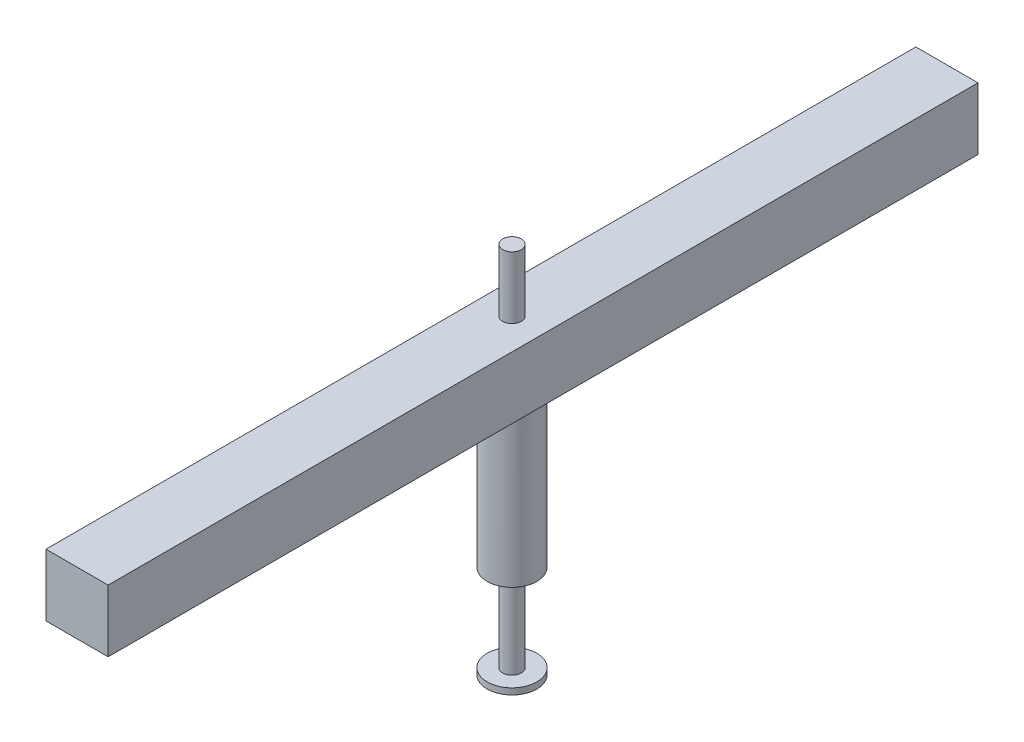
from build123d import *

# Parameters (mm, degrees)
SKETCH1_W                = 100
SKETCH1_H                = 100
BOSS_EXTRUDE1_DEPTH      = 1400
BOSS_EXTRUDE3_DEPTH      = 400
BOSS_EXTRUDE3_DEPTH_BACK = 200
SKETCH3_R                = 15
SKETCH4_R                = 40
BOSS_EXTRUDE4_DEPTH      = 10
BOSS_EXTRUDE5_START      = 250
SKETCH5_R                = 40
BOSS_EXTRUDE5_DEPTH      = 250


with BuildPart() as part:
    # Sketch1 → Boss-Extrude1 (new body)
    with BuildSketch(Plane.XY):
        Rectangle(SKETCH1_W, SKETCH1_H)
    extrude(amount=BOSS_EXTRUDE1_DEPTH)

    # Sketch3 → Boss-Extrude3 (add, two sides: drawn at the far end of the back side and taken through both)
    with BuildSketch(Plane.XZ.offset(50).offset(-BOSS_EXTRUDE3_DEPTH_BACK)):
        with Locations((0, 700)):
            Circle(SKETCH3_R)
    extrude(amount=BOSS_EXTRUDE3_DEPTH + BOSS_EXTRUDE3_DEPTH_BACK)

    # Sketch4 → Boss-Extrude4 (add)
    with BuildSketch(Plane.XZ.offset(450)):
        with Locations((0, 700)):
            Circle(SKETCH4_R)
    extrude(amount=-BOSS_EXTRUDE4_DEPTH)

    # Sketch5 → Boss-Extrude5 (add)
    with BuildSketch(Plane.XZ.offset(50).offset(BOSS_EXTRUDE5_START)):
        with Locations(Location((0, 700, 0), (0, 0, 180))):
            Circle(SKETCH5_R)
    extrude(amount=-BOSS_EXTRUDE5_DEPTH)


solid = part.part
